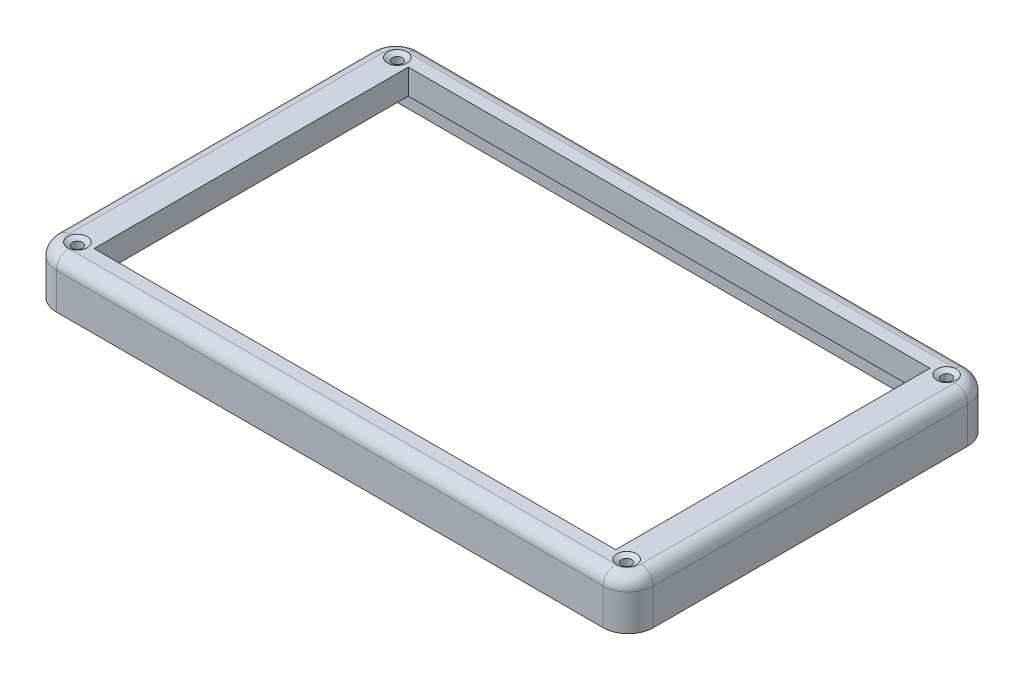
from build123d import *

# Parameters (mm, degrees)
SKETCH_1_W          = 190
SKETCH_1_H          = 116
SKETCH_1_W_2        = 166
SKETCH_1_H_2        = 100
EXTRUDE_2_DEPTH     = 8
SKETCH_2_W          = 190
SKETCH_2_H          = 116
SKETCH_2_W_2        = 182
SKETCH_2_H_2        = 108
EXTRUDE_3_DEPTH     = 7.5
FILLET_1_R          = 8
SKETCH_3_W          = 15
SKETCH_3_H          = 7.5
CUT_EXTRUDE_1_DEPTH = 7.5
SKETCH_4_W          = 16
SKETCH_4_H          = 3
CUT_EXTRUDE_2_DEPTH = 35.5
SKETCH_5_R          = 1.6
CUT_EXTRUDE_3_DEPTH = 35.5
CHAMFER_1_SIZE      = 1.5
CHAMFER_1_SIZE2     = 0.866025404
SKETCH_6_W          = 22
SKETCH_6_H          = 2.5
CUT_EXTRUDE_4_DEPTH = 4
FILLET_2_R          = 4


with BuildPart() as part:
    # 草图1 → 凸台-拉伸2 (new body)
    with BuildSketch(Plane(origin=(0, 0, 0), x_dir=(1, 0, 0), z_dir=(0, 1, 0))):
        Rectangle(SKETCH_1_W, SKETCH_1_H)
        Rectangle(SKETCH_1_W_2, SKETCH_1_H_2, mode=Mode.SUBTRACT)
    extrude(amount=EXTRUDE_2_DEPTH)

    # 草图2 → 凸台-拉伸3 (add)
    with BuildSketch(Plane.XZ):
        Rectangle(SKETCH_2_W, SKETCH_2_H)
        Rectangle(SKETCH_2_W_2, SKETCH_2_H_2, mode=Mode.SUBTRACT)
    extrude(amount=EXTRUDE_3_DEPTH)

    # 圆角1
    fillet_1_edges = [part.edges().sort_by_distance(p)[0] for p in [
        (-95, 0.25, 58),
        (95, 0.25, 58),
        (95, 0.25, -58),
        (-95, 0.25, -58),
    ]]
    fillet(fillet_1_edges, radius=FILLET_1_R)

    # 草图3 → 切除-拉伸1 (cut)
    with BuildSketch(Plane.ZY.offset(95)):
        with Locations((0, -3.75)):
            Rectangle(SKETCH_3_W, SKETCH_3_H)
    extrude(amount=-CUT_EXTRUDE_1_DEPTH, mode=Mode.SUBTRACT)

    # 草图4 → 切除-拉伸2 (cut)
    with BuildSketch(Plane(origin=(0, 0, -58), x_dir=(-1, 0, 0), z_dir=(0, 0, -1))):
        with Locations((-62, -2.5)):
            Rectangle(SKETCH_4_W, SKETCH_4_H)
    extrude(amount=-CUT_EXTRUDE_2_DEPTH, mode=Mode.SUBTRACT)

    # 草图5 → 切除-拉伸3 (cut)
    with BuildSketch(Plane(origin=(0, 8, 0), x_dir=(1, 0, 0), z_dir=(0, 1, 0))):
        with Locations(Location((-87.4, 50.9, 0), (0, 0, 270))):
            Circle(SKETCH_5_R)
        with Locations(Location((-87.4, -50.9, 0), (0, 0, 90))):
            Circle(SKETCH_5_R)
        with Locations(Location((87.4, -50.9, 0), (0, 0, 270))):
            Circle(SKETCH_5_R)
        with Locations(Location((87.4, 50.9, 0), (0, 0, 90))):
            Circle(SKETCH_5_R)
    extrude(amount=-CUT_EXTRUDE_3_DEPTH, mode=Mode.SUBTRACT)

    # 倒角1
    chamfer_1_edges = [part.edges().sort_by_distance(p)[0] for p in [
        (87.4, 8, -49.3),
        (87.4, 8, 49.3),
        (-87.4, 8, 52.5),
        (-87.4, 8, -52.5),
    ]]
    chamfer_1_side = [part.faces().sort_by_distance(p)[0] for p in [
        (0, 8, -55.773882303),
    ]]
    chamfer(chamfer_1_edges, length=CHAMFER_1_SIZE, length2=CHAMFER_1_SIZE2, reference=chamfer_1_side[0])

    # 草图6 → 切除-拉伸4 (cut)
    with BuildSketch(Plane.ZY.offset(95)):
        with Locations((-32.5, -6.35)):
            Rectangle(SKETCH_6_W, SKETCH_6_H)
    extrude(amount=-CUT_EXTRUDE_4_DEPTH, mode=Mode.SUBTRACT)

    # 圆角2
    fillet_2_edges = [part.edges().sort_by_distance(p)[0] for p in [
        (95, 8, 0),
        (0, 8, 58),
        (-95, 8, 0),
        (0, 8, -58),
        (-92.656854249, 8, 55.656854249),
        (-92.656854249, 8, -55.656854249),
        (92.656854249, 8, -55.656854249),
        (92.656854249, 8, 55.656854249),
    ]]
    fillet(fillet_2_edges, radius=FILLET_2_R)


solid = part.part
